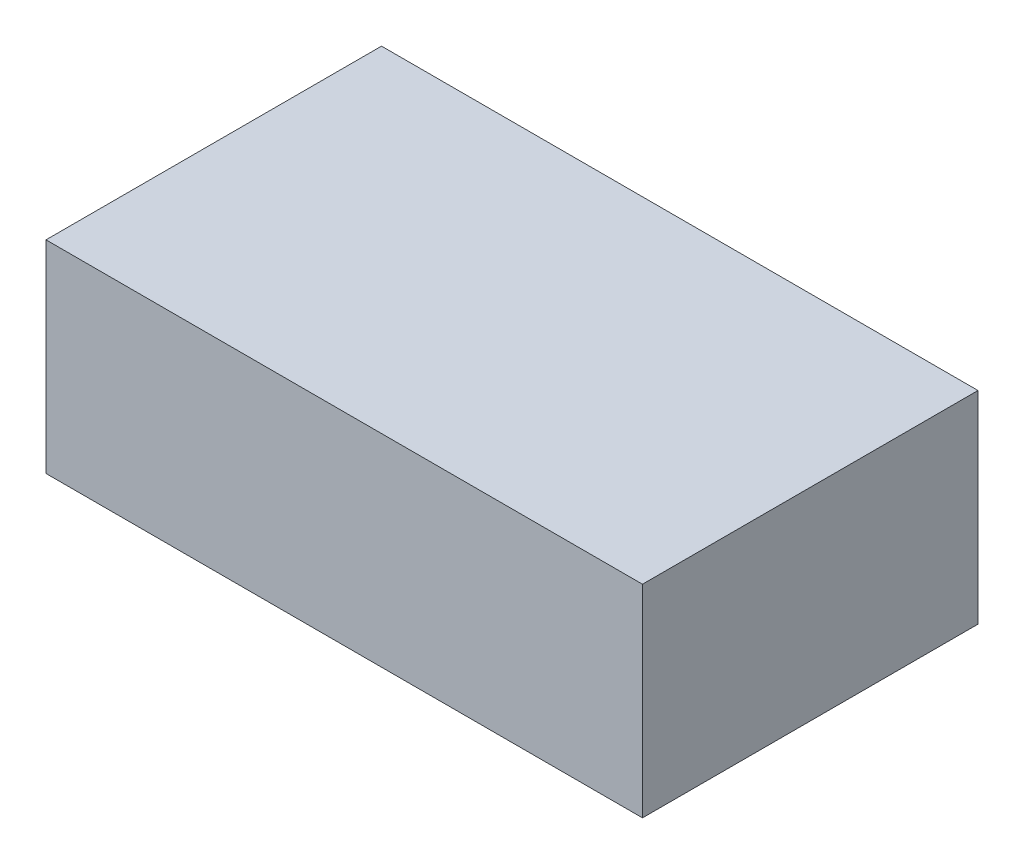
from build123d import *

# Parameters (mm, degrees)
SKETCH_1_W      = 112
SKETCH_1_H      = 63
EXTRUDE_1_DEPTH = 38


with BuildPart() as part:
    # 草图1 → 凸台-拉伸1 (new body)
    with BuildSketch(Plane(origin=(0, 0, 0), x_dir=(1, 0, 0), z_dir=(0, 1, 0))):
        Rectangle(SKETCH_1_W, SKETCH_1_H)
    extrude(amount=EXTRUDE_1_DEPTH)


solid = part.part
